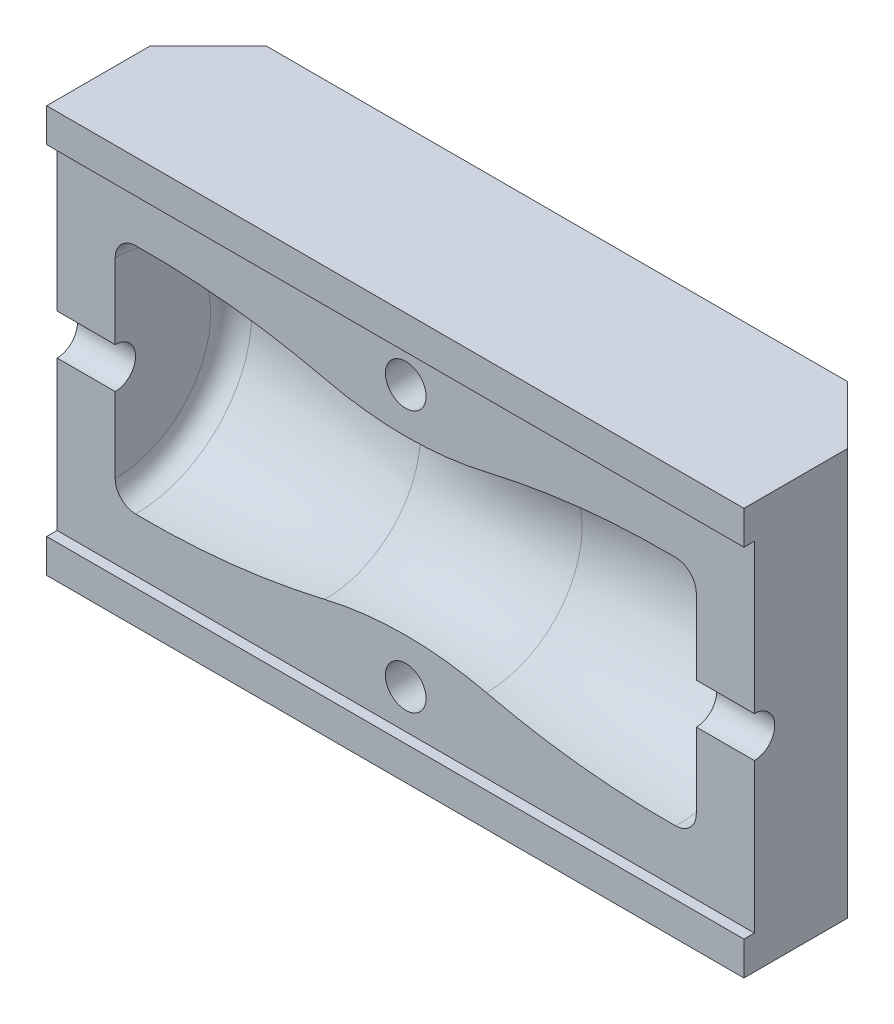
from build123d import *

# Parameters (mm, degrees)
SKETCH1_W               = 60
SKETCH1_H               = 35
BOSS_EXTRUDE1_DEPTH     = 13
CUT_EXTRUDE1_DEPTH      = 64.837684937
CUT_EXTRUDE1_DEPTH_BACK = 64.837684937
SKETCH3_R               = 1.75
SKETCH5_R               = 1.75
CUT_EXTRUDE3_DEPTH      = 38.08436341
CHAMFER1_SIZE           = 5
CUT_EXTRUDE4_DEPTH      = 7
SKETCH4_W               = 60
SKETCH4_H               = 2.9
BOSS_EXTRUDE2_DEPTH     = 0.9
CHAMFER2_SIZE           = 0.5


with BuildPart() as part:
    # Sketch1 → Boss-Extrude1 (new body)
    with BuildSketch(Plane.XY):
        Rectangle(SKETCH1_W, SKETCH1_H)
    extrude(amount=BOSS_EXTRUDE1_DEPTH)

    # Sketch2 → Cut-Revolve1 (revolve, cut)
    with BuildSketch(Plane.XY.offset(13)):
        with BuildLine():
            Line((-25, 0), (-25, 8.218127455))
            ThreePointArc((-25, 8.218127455), (-24.486963528, 9.469250598), (-23.243251097, 10))
            ThreePointArc((-23.243251097, 10), (-15.040879193, 9.611248064), (-6.94833646, 8.218127455))
            ThreePointArc((-6.94833646, 8.218127455), (0, 7.408356031), (6.94833646, 8.218127455))
            ThreePointArc((6.94833646, 8.218127455), (15.040879193, 9.611248064), (23.243251097, 10))
            ThreePointArc((23.243251097, 10), (24.486963528, 9.469250598), (25, 8.218127455))
            Line((25, 8.218127455), (25, 0))
            Line((25, 0), (-25, 0))
        make_face()
    revolve(axis=Axis((25, 0, 13), (-1, 0, 0)), mode=Mode.SUBTRACT)

    # Sketch3 → Cut-Extrude1 (cut, two sides: drawn at the far end of the back side and taken through both)
    with BuildSketch(Plane(origin=(30, 0, 0), x_dir=(0, 0, -1), z_dir=(1, 0, 0)).offset(-CUT_EXTRUDE1_DEPTH_BACK)):
        with Locations((-13, 0)):
            Circle(SKETCH3_R)
    extrude(amount=CUT_EXTRUDE1_DEPTH + CUT_EXTRUDE1_DEPTH_BACK, mode=Mode.SUBTRACT)

    # Sketch5 → Cut-Extrude3 (cut, through all)
    with BuildSketch(Plane.XY.offset(13)):
        with Locations((0, 11.25)):
            Circle(SKETCH5_R)
        with Locations((0, -11.25)):
            Circle(SKETCH5_R)
    extrude(amount=-CUT_EXTRUDE3_DEPTH, mode=Mode.SUBTRACT)

    # Chamfer1
    chamfer1_edges = [part.edges().sort_by_distance(p)[0] for p in [
        (-30, 0, 0),
        (30, 0, 0),
    ]]
    chamfer(chamfer1_edges, length=CHAMFER1_SIZE)

    # Sketch6 → Cut-Extrude4 (cut)
    with BuildSketch(Plane(origin=(0, 0, 0), x_dir=(-1, 0, 0), z_dir=(0, 0, -1))):
        Polygon((3.464101615, 11.25), (1.732050808, 14.25), (-1.732050808, 14.25), (-3.464101615, 11.25), (-1.732050808, 8.25), (1.732050808, 8.25), align=None)
        Polygon((3.464101615, -11.25), (1.732050808, -8.25), (-1.732050808, -8.25), (-3.464101615, -11.25), (-1.732050808, -14.25), (1.732050808, -14.25), align=None)
    extrude(amount=-CUT_EXTRUDE4_DEPTH, mode=Mode.SUBTRACT)

    # Sketch4 → Boss-Extrude2 (add)
    with BuildSketch(Plane.XY.offset(13)):
        with Locations((0, 16.05)):
            Rectangle(SKETCH4_W, SKETCH4_H)
        with Locations((0, -16.05)):
            Rectangle(SKETCH4_W, SKETCH4_H)
    extrude(amount=BOSS_EXTRUDE2_DEPTH)

    # Chamfer2
    chamfer2_edges = [part.edges().sort_by_distance(p)[0] for p in [
        (-2.598076211, 9.75, 0),
        (-2.598076211, 12.75, 0),
        (0, 14.25, 0),
        (2.598076211, 12.75, 0),
        (2.598076211, 9.75, 0),
        (0, 8.25, 0),
        (-2.598076211, 9.75, 7),
        (0, 8.25, 7),
        (2.598076211, 9.75, 7),
        (2.598076211, 12.75, 7),
        (0, 14.25, 7),
        (-2.598076211, 12.75, 7),
        (-1.75, 11.25, 7),
        (-2.598076211, -12.75, 0),
        (-2.598076211, -9.75, 0),
        (0, -8.25, 0),
        (2.598076211, -9.75, 0),
        (2.598076211, -12.75, 0),
        (0, -14.25, 0),
        (-2.598076211, -12.75, 7),
        (0, -14.25, 7),
        (2.598076211, -12.75, 7),
        (2.598076211, -9.75, 7),
        (0, -8.25, 7),
        (-2.598076211, -9.75, 7),
        (-1.75, -11.25, 7),
    ]]
    chamfer(chamfer2_edges, length=CHAMFER2_SIZE)


solid = part.part
